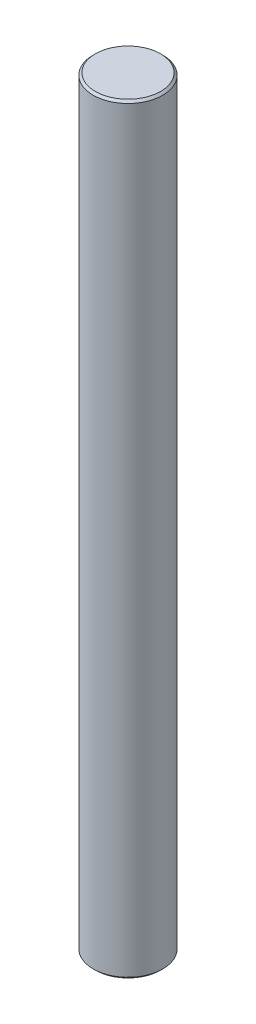
from build123d import *

# Parameters (mm, degrees)
SKETCH_1_R      = 16
EXTRUDE_1_DEPTH = 350
CHAMFER_1_SIZE  = 1


with BuildPart() as part:
    # 草图1 → 凸台-拉伸1 (new body)
    with BuildSketch(Plane(origin=(0, 0, 0), x_dir=(1, 0, 0), z_dir=(0, 1, 0))):
        with Locations(Location((0, 0, 0), (0, 0, 270))):
            Circle(SKETCH_1_R)
    extrude(amount=EXTRUDE_1_DEPTH)

    # 倒角1
    chamfer_1_edges = [part.edges().sort_by_distance(p)[0] for p in [
        (0, 0, -16),
        (0, 350, -16),
    ]]
    chamfer(chamfer_1_edges, length=CHAMFER_1_SIZE)


solid = part.part
